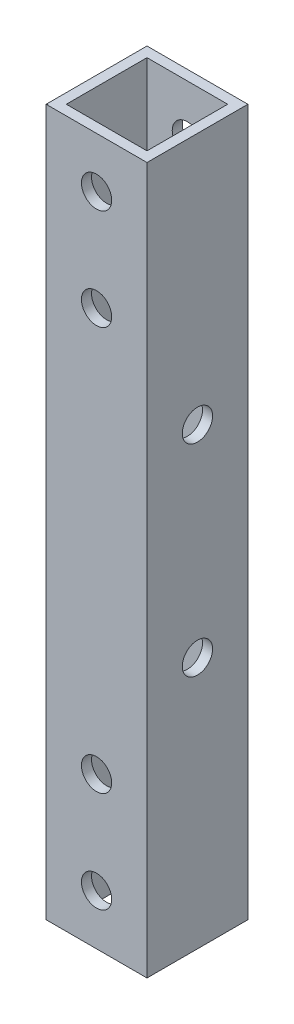
from build123d import *

# Parameters (mm, degrees)
SKETCH_1_W          = 10
SKETCH_1_H          = 10
SKETCH_1_W_2        = 8
SKETCH_1_H_2        = 8
EXTRUDE_1_DEPTH     = 70
SKETCH_2_R          = 1.5
CUT_EXTRUDE_1_DEPTH = 30
SKETCH_3_R          = 1.5
CUT_EXTRUDE_2_DEPTH = 30


with BuildPart() as part:
    # 草图1 → 凸台-拉伸1 (new body)
    with BuildSketch(Plane(origin=(0, 0, 0), x_dir=(1, 0, 0), z_dir=(0, 1, 0))):
        Rectangle(SKETCH_1_W, SKETCH_1_H)
        Rectangle(SKETCH_1_W_2, SKETCH_1_H_2, mode=Mode.SUBTRACT)
    extrude(amount=EXTRUDE_1_DEPTH)

    # 草图2 → 切除-拉伸1 (cut)
    with BuildSketch(Plane.ZY.offset(5)):
        with Locations((0, 25)):
            Circle(SKETCH_2_R)
        with Locations((0, 45)):
            Circle(SKETCH_2_R)
    extrude(amount=-CUT_EXTRUDE_1_DEPTH, mode=Mode.SUBTRACT)

    # 草图3 → 切除-拉伸2 (cut)
    with BuildSketch(Plane(origin=(0, 0, -5), x_dir=(-1, 0, 0), z_dir=(0, 0, -1))):
        with Locations((0, 65)):
            Circle(SKETCH_3_R)
        with Locations((0, 55)):
            Circle(SKETCH_3_R)
        with Locations((0, 15)):
            Circle(SKETCH_3_R)
        with Locations((0, 5)):
            Circle(SKETCH_3_R)
    extrude(amount=-CUT_EXTRUDE_2_DEPTH, mode=Mode.SUBTRACT)


solid = part.part
